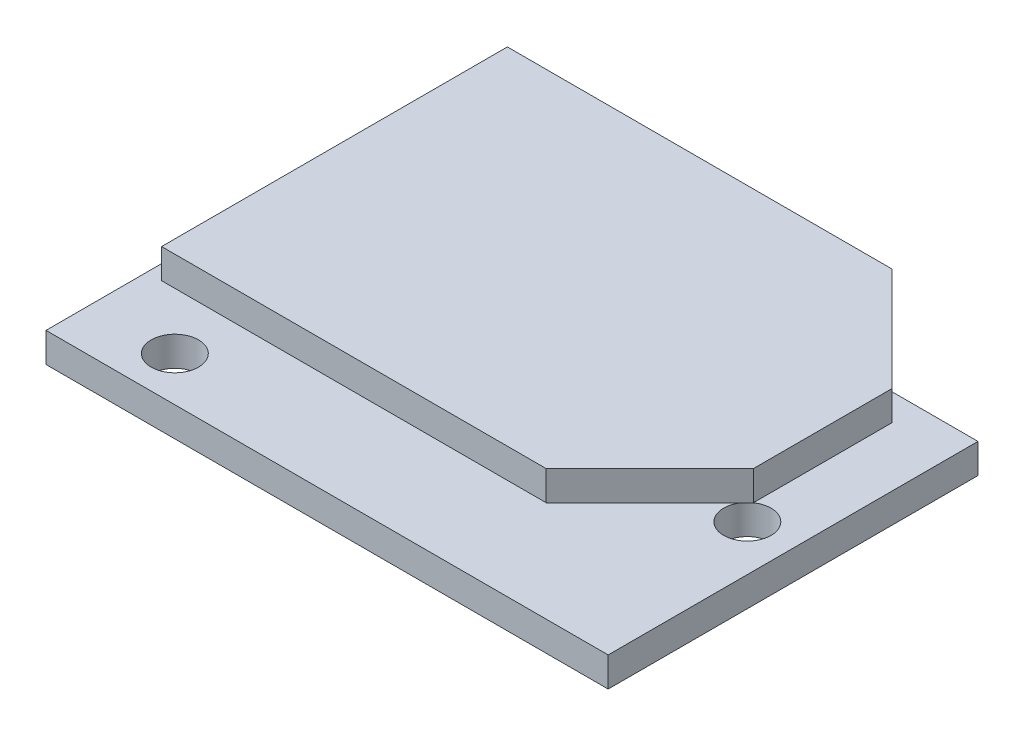
from build123d import *

# Parameters (mm, degrees)
SKETCH1_W           = 38
SKETCH1_H           = 25
SKETCH1_R           = 1.6
BOSS_EXTRUDE1_DEPTH = 2
BOSS_EXTRUDE2_START = 6
BOSS_EXTRUDE2_DEPTH = 2


with BuildPart() as part:
    # Sketch1 → Boss-Extrude1 (new body)
    with BuildSketch(Plane(origin=(0, 0, 0), x_dir=(1, 0, 0), z_dir=(0, 1, 0))):
        with Locations((19, 0)):
            Rectangle(SKETCH1_W, SKETCH1_H)
        with Locations(Location((5.71, 9.5, 0), (0, 0, 270))):
            Circle(SKETCH1_R, mode=Mode.SUBTRACT)
        with Locations(Location((5.71, -9.5, 0), (0, 0, 90))):
            Circle(SKETCH1_R, mode=Mode.SUBTRACT)
        with Locations(Location((34.91, 0, 0), (0, 0, 270))):
            Circle(SKETCH1_R, mode=Mode.SUBTRACT)
    extrude(amount=BOSS_EXTRUDE1_DEPTH)


with BuildPart() as body_2:
    # Sketch2 → Boss-Extrude2 (new body)
    with BuildSketch(Plane(origin=(0, 2, 0), x_dir=(1, 0, 0), z_dir=(0, 1, 0)).offset(BOSS_EXTRUDE2_START)):
        Polygon((33, -11.686418873), (40, -4.686418873), (40, 4.686418873), (33, 11.686418873), (7, 11.686418873), (7, -11.686418873), align=None)
    extrude(amount=BOSS_EXTRUDE2_DEPTH)


solid = Compound([part.part, body_2.part])
